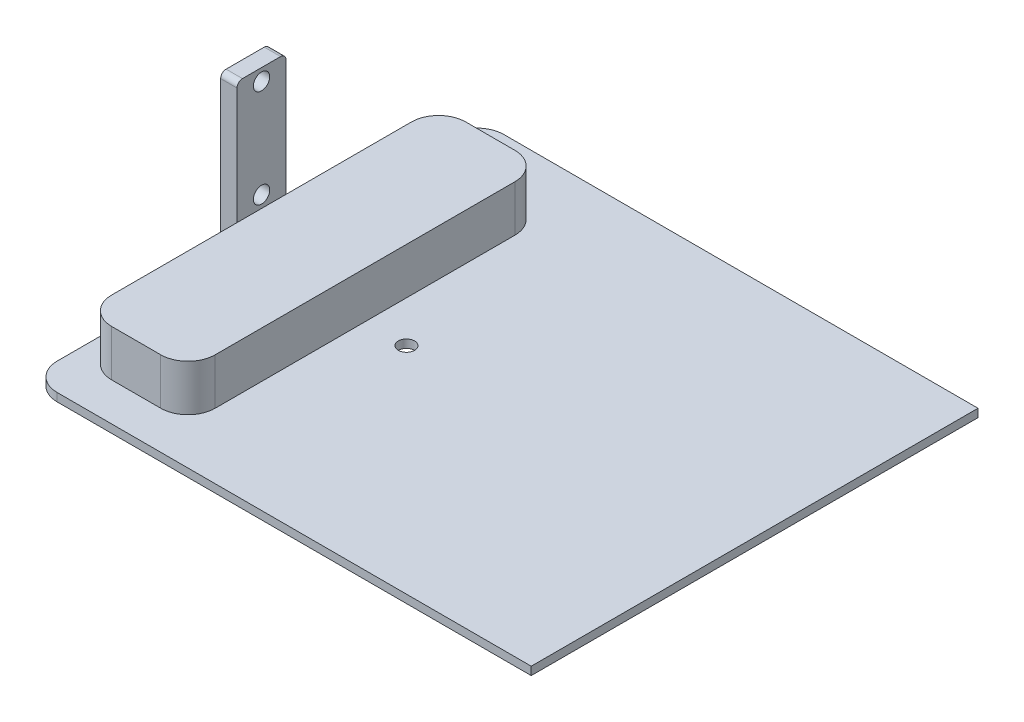
from build123d import *

# Parameters (mm, degrees)
ESBO_O1_W                = 92
ESBO_O1_H                = 82
RESSALTO_EXTRUS_O1_DEPTH = 1.5
ESBO_O2_W                = 19
ESBO_O2_H                = 65
RESSALTO_EXTRUS_O2_DEPTH = 8.5
ESBO_O3_W                = 3
ESBO_O3_H                = 9
RESSALTO_EXTRUS_O3_DEPTH = 30.9
ESBO_O4_R                = 1.5
CORTE_EXTRUS_O1_DEPTH    = 3
ESBO_O5_R                = 1.5
CORTE_EXTRUS_O2_DEPTH    = 1.5
FILETE1_R                = 5
FILETE2_R                = 1


with BuildPart() as part:
    # Esboço1 → Ressalto-extrusão1 (new body)
    with BuildSketch(Plane(origin=(0, 0, 0), x_dir=(1, 0, 0), z_dir=(0, 1, 0))):
        Rectangle(ESBO_O1_W, ESBO_O1_H)
    extrude(amount=RESSALTO_EXTRUS_O1_DEPTH)

    # Esboço2 → Ressalto-extrusão2 (add)
    with BuildSketch(Plane(origin=(0, 1.5, 0), x_dir=(1, 0, 0), z_dir=(0, 1, 0))):
        with Locations((-33.5, -1.5)):
            Rectangle(ESBO_O2_W, ESBO_O2_H)
    extrude(amount=RESSALTO_EXTRUS_O2_DEPTH)

    # Esboço3 → Ressalto-extrusão3 (add)
    with BuildSketch(Plane(origin=(0, 1.5, 0), x_dir=(1, 0, 0), z_dir=(0, 1, 0))):
        with Locations((-44.5, -1.5)):
            Rectangle(ESBO_O3_W, ESBO_O3_H)
    extrude(amount=RESSALTO_EXTRUS_O3_DEPTH)

    # Esboço4 → Corte-extrusão1 (cut)
    with BuildSketch(Plane(origin=(-46, 0, 0), x_dir=(0, 0, -1), z_dir=(1, 0, 0))):
        with Locations(Location((-1.5, 30.2, 0), (0, 0, 180))):
            Circle(ESBO_O4_R)
        with Locations(Location((-1.5, 12.2, 0), (0, 0, 180))):
            Circle(ESBO_O4_R)
    extrude(amount=CORTE_EXTRUS_O1_DEPTH, mode=Mode.SUBTRACT)

    # Esboço5 → Corte-extrusão2 (cut)
    with BuildSketch(Plane(origin=(0, 1.5, 0), x_dir=(1, 0, 0), z_dir=(0, 1, 0))):
        with Locations(Location((-16.4, -1.5, 0), (0, 0, 270))):
            Circle(ESBO_O5_R)
    extrude(amount=-CORTE_EXTRUS_O2_DEPTH, mode=Mode.SUBTRACT)

    # Filete1
    filete1_edges = [part.edges().sort_by_distance(p)[0] for p in [
        (-43, 5.75, -31),
        (-43, 5.75, 34),
        (-24, 5.75, 34),
        (-24, 5.75, -31),
        (-44.5, 1.5, 6),
        (-44.5, 1.5, -3),
        (-46, 0.75, 41),
        (-46, 0.75, -41),
    ]]
    fillet(filete1_edges, radius=FILETE1_R)

    # Filete2
    filete2_edges = [part.edges().sort_by_distance(p)[0] for p in [
        (-44.5, 32.4, 6),
        (-44.5, 32.4, -3),
    ]]
    fillet(filete2_edges, radius=FILETE2_R)


solid = part.part
